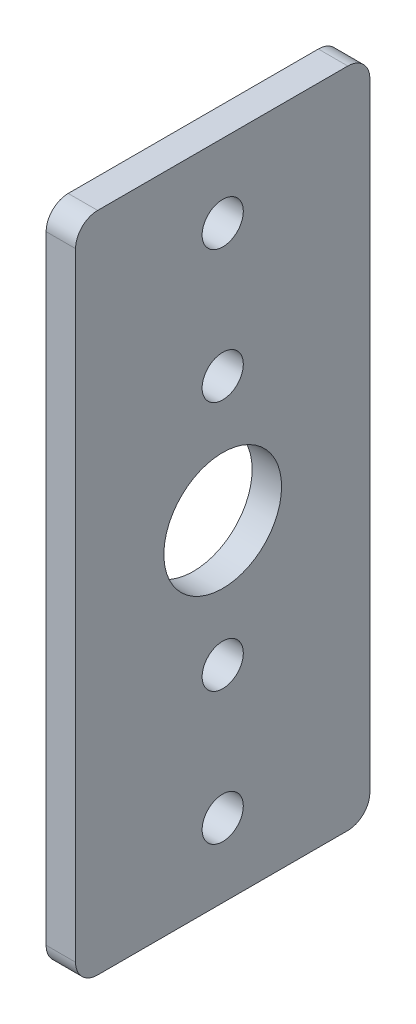
from build123d import *

# Parameters (mm, degrees)
SKETCH2_W           = 20
SKETCH2_H           = 45
SKETCH2_R           = 4
SKETCH2_R_2         = 1.4
BOSS_EXTRUDE1_DEPTH = 2
FILLET1_R           = 1.5


with BuildPart() as part:
    # Sketch2 → Boss-Extrude1 (new body)
    with BuildSketch(Plane(origin=(0, 0, 0), x_dir=(0, 0, -1), z_dir=(1, 0, 0))):
        with Locations((0.605906028, -63.756611905)):
            Rectangle(SKETCH2_W, SKETCH2_H)
        with Locations((0.605906028, -63.756611905)):
            Circle(SKETCH2_R, mode=Mode.SUBTRACT)
        with Locations((0.605906028, -46.256611905)):
            Circle(SKETCH2_R_2, mode=Mode.SUBTRACT)
        with Locations((0.605906028, -55.256611905)):
            Circle(SKETCH2_R_2, mode=Mode.SUBTRACT)
        with Locations((0.605906028, -72.256611905)):
            Circle(SKETCH2_R_2, mode=Mode.SUBTRACT)
        with Locations((0.605906028, -81.256611905)):
            Circle(SKETCH2_R_2, mode=Mode.SUBTRACT)
    extrude(amount=BOSS_EXTRUDE1_DEPTH)

    # Fillet1
    fillet1_edges = [part.edges().sort_by_distance(p)[0] for p in [
        (1, -41.256611905, 9.394093972),
        (1, -41.256611905, -10.605906028),
        (1, -86.256611905, -10.605906028),
        (1, -86.256611905, 9.394093972),
    ]]
    fillet(fillet1_edges, radius=FILLET1_R)


solid = part.part
